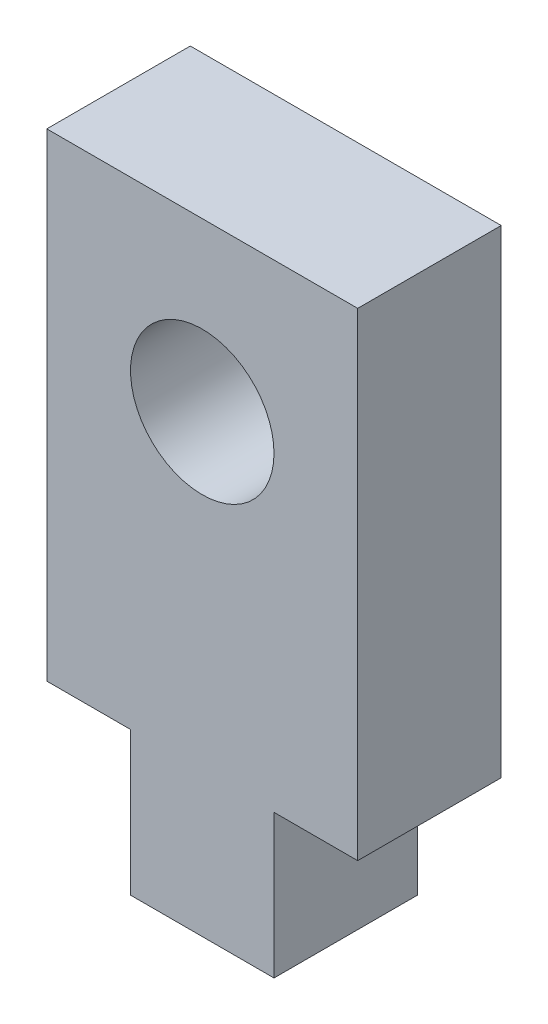
from build123d import *

# Parameters (mm, degrees)
CROQUIS2_R              = 1.5
SALIENTE_EXTRUIR1_DEPTH = 3


with BuildPart() as part:
    # Croquis2 → Saliente-Extruir1 (new body)
    with BuildSketch(Plane.XY):
        Polygon((-3.25, -5), (-3.25, 5), (3.25, 5), (3.25, -5), (1.5, -5), (1.5, -8), (-1.5, -8), (-1.5, -5), align=None)
        with Locations((0, 1.5)):
            Circle(CROQUIS2_R, mode=Mode.SUBTRACT)
    extrude(amount=SALIENTE_EXTRUIR1_DEPTH)


solid = part.part
